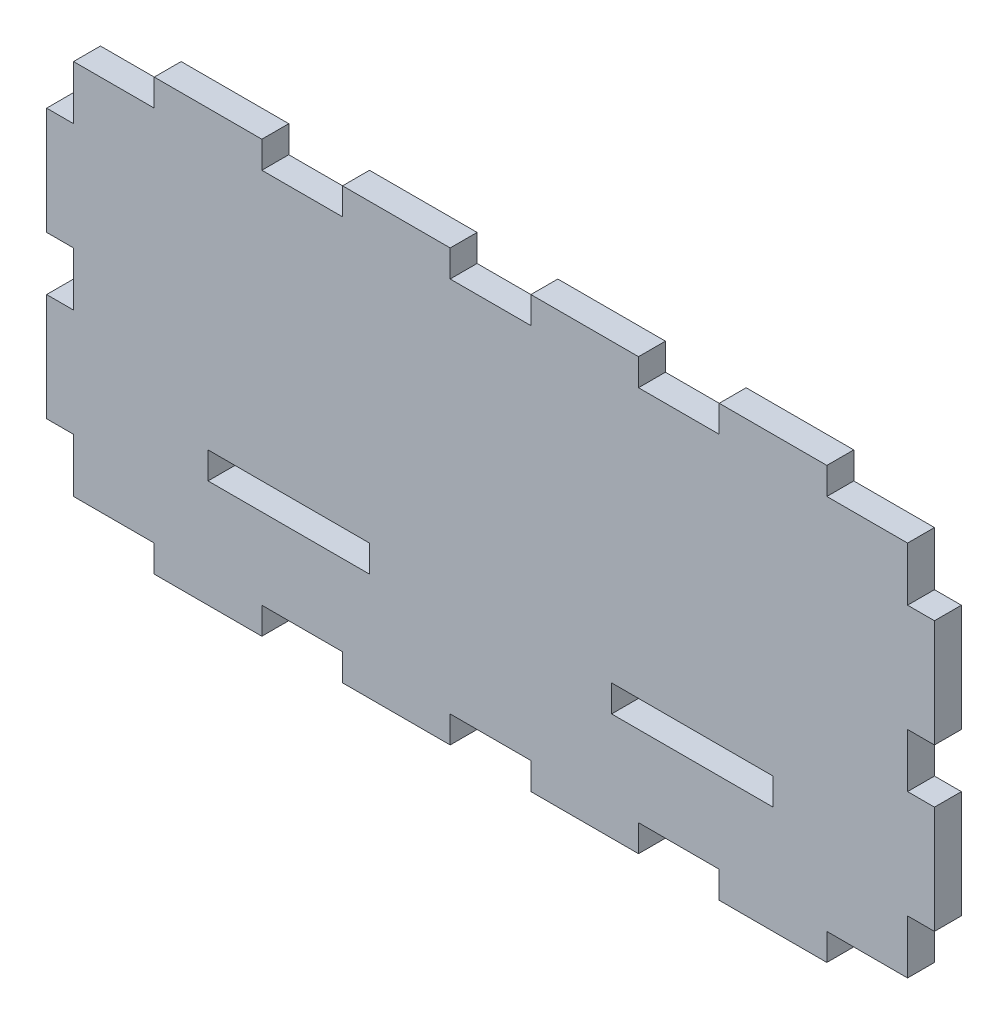
from build123d import *

# Parameters (mm, degrees)
BOSS_EXTRUDE1_DEPTH = 5
SKETCH2_W           = 30
SKETCH2_H           = 5
CUT_EXTRUDE1_DEPTH  = 5


with BuildPart() as part:
    # Sketch1 → Boss-Extrude1 (new body)
    with BuildSketch(Plane.XY):
        Polygon((-75.513214474, 35), (-60.513214474, 35), (-60.513214474, 40), (-40.513214474, 40), (-40.513214474, 35), (-25.513214474, 35), (-25.513214474, 40), (-5.513214474, 40), (-5.513214474, 35), (9.486785526, 35), (9.486785526, 40), (29.486785526, 40), (29.486785526, 35), (44.486785526, 35), (44.486785526, 40), (64.486785526, 40), (64.486785526, 35), (79.486785526, 35), (79.486785526, 25), (84.486785526, 25), (84.486785526, 5), (79.486785526, 5), (79.486785526, -5), (84.486785526, -5), (84.486785526, -25), (79.486785526, -25), (79.486785526, -35), (64.486785526, -35), (64.486785526, -40), (44.486785526, -40), (44.486785526, -35), (29.486785526, -35), (29.486785526, -40), (9.486785526, -40), (9.486785526, -35), (-5.513214474, -35), (-5.513214474, -40), (-25.513214474, -40), (-25.513214474, -35), (-40.513214474, -35), (-40.513214474, -40), (-60.513214474, -40), (-60.513214474, -35), (-75.513214474, -35), (-75.513214474, -25), (-80.513214474, -25), (-80.513214474, -5), (-75.513214474, -5), (-75.513214474, 5), (-80.513214474, 5), (-80.513214474, 25), (-75.513214474, 25), align=None)
    extrude(amount=BOSS_EXTRUDE1_DEPTH)

    # Sketch2 → Cut-Extrude1 (cut)
    with BuildSketch(Plane.XY.offset(5)):
        with Locations((39.486785526, -17.5)):
            Rectangle(SKETCH2_W, SKETCH2_H)
        with Locations((-35.513214474, -17.5)):
            Rectangle(SKETCH2_W, SKETCH2_H)
    extrude(amount=-CUT_EXTRUDE1_DEPTH, mode=Mode.SUBTRACT)


solid = part.part
